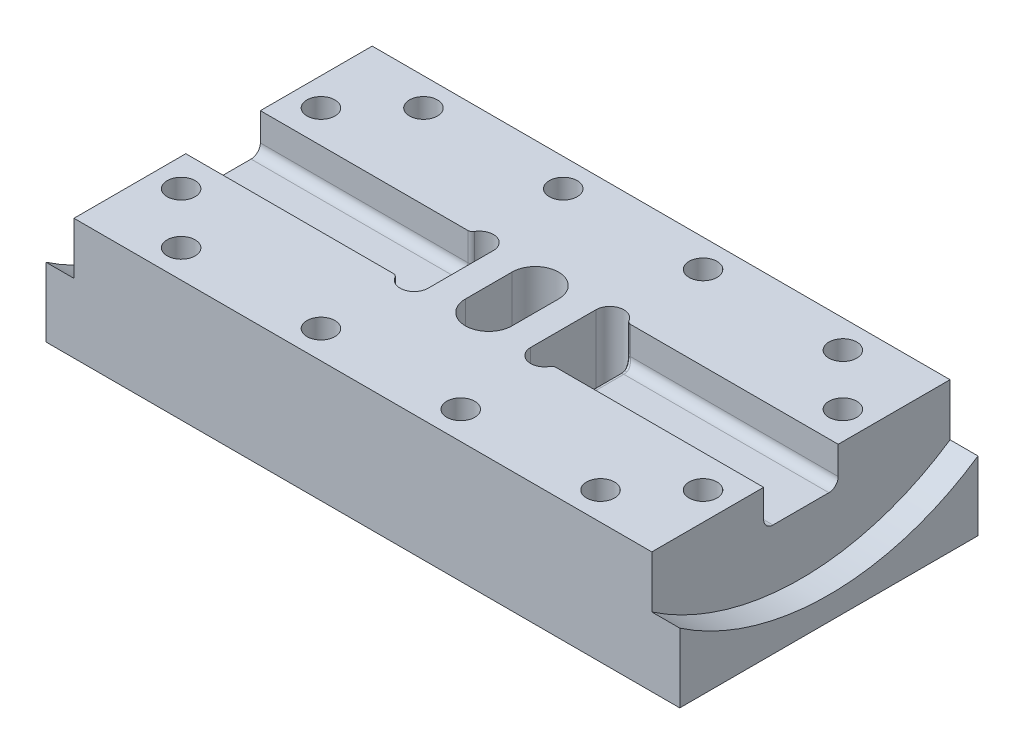
from build123d import *

# Parameters (mm, degrees)
SKETCH1_W           = 68
SKETCH1_H           = 32
BOSS_EXTRUDE1_DEPTH = 13
SKETCH2_R           = 1.5
CUT_EXTRUDE1_DEPTH  = 40.761790704
CUT_EXTRUDE2_DEPTH  = 40.761790704
CUT_EXTRUDE3_START  = -34
CUT_EXTRUDE3_DEPTH  = 3
CUT_EXTRUDE4_START  = 31
CUT_EXTRUDE4_DEPTH  = 3
CUT_EXTRUDE5_DEPTH  = 23
CUT_EXTRUDE6_START  = -23
CUT_EXTRUDE6_DEPTH  = 23
FILLET1_R           = 0.5


with BuildPart() as part:
    # Sketch1 → Boss-Extrude1 (new body)
    with BuildSketch(Plane(origin=(0, 0, 0), x_dir=(1, 0, 0), z_dir=(0, 1, 0))):
        Rectangle(SKETCH1_W, SKETCH1_H)
    extrude(amount=BOSS_EXTRUDE1_DEPTH)

    # Sketch2 → Cut-Extrude1 (cut, through all)
    with BuildSketch(Plane(origin=(0, 13, 0), x_dir=(1, 0, 0), z_dir=(0, 1, 0))):
        with Locations(Location((-28, 7.5, 0), (0, 0, 270))):
            Circle(SKETCH2_R)
        with Locations(Location((-28, -7.5, 0), (0, 0, 270))):
            Circle(SKETCH2_R)
        with Locations(Location((28, -7.5, 0), (0, 0, 270))):
            Circle(SKETCH2_R)
        with Locations(Location((28, 7.5, 0), (0, 0, 270))):
            Circle(SKETCH2_R)
        with Locations(Location((-22.5, 13, 0), (0, 0, 270))):
            Circle(SKETCH2_R)
        with Locations(Location((-7.5, 13, 0), (0, 0, 270))):
            Circle(SKETCH2_R)
        with Locations(Location((7.5, 13, 0), (0, 0, 270))):
            Circle(SKETCH2_R)
        with Locations(Location((22.5, 13, 0), (0, 0, 270))):
            Circle(SKETCH2_R)
        with Locations(Location((-22.5, -13, 0), (0, 0, 270))):
            Circle(SKETCH2_R)
        with Locations(Location((-7.5, -13, 0), (0, 0, 270))):
            Circle(SKETCH2_R)
        with Locations(Location((7.5, -13, 0), (0, 0, 270))):
            Circle(SKETCH2_R)
        with Locations(Location((22.5, -13, 0), (0, 0, 270))):
            Circle(SKETCH2_R)
    extrude(amount=-CUT_EXTRUDE1_DEPTH, mode=Mode.SUBTRACT)

    # Sketch3 → Cut-Extrude2 (cut, through all)
    with BuildSketch(Plane(origin=(0, 13, 0), x_dir=(1, 0, 0), z_dir=(0, 1, 0))):
        with BuildLine():
            Line((-2.5, -2.5), (-2.5, 2.5))
            ThreePointArc((-2.5, 2.5), (0, 5), (2.5, 2.5))
            Line((2.5, 2.5), (2.5, -2.5))
            ThreePointArc((2.5, -2.5), (0, -5), (-2.5, -2.5))
        make_face()
        with BuildLine():
            Line((-8.5, -3.5), (-8.5, 3.5))
            ThreePointArc((-8.5, 3.5), (-7, 5), (-5.5, 3.5))
            Line((-5.5, 3.5), (-5.5, -3.5))
            ThreePointArc((-5.5, -3.5), (-7, -5), (-8.5, -3.5))
        make_face()
        with BuildLine():
            Line((8.5, -3.5), (8.5, 3.5))
            ThreePointArc((8.5, 3.5), (7, 5), (5.5, 3.5))
            Line((5.5, 3.5), (5.5, -3.5))
            ThreePointArc((5.5, -3.5), (7, -5), (8.5, -3.5))
        make_face()
    extrude(amount=-CUT_EXTRUDE2_DEPTH, mode=Mode.SUBTRACT)

    # Sketch5 → Cut-Extrude3 (cut)
    with BuildSketch(Plane(origin=(0, 0, 0), x_dir=(0, 0, -1), z_dir=(1, 0, 0)).offset(CUT_EXTRUDE3_START)):
        with BuildLine():
            Line((16, 7.41504717), (16, 13))
            Line((16, 13), (-16, 13))
            Line((-16, 13), (-16, 7.41504717))
            ThreePointArc((-16, 7.41504717), (0, 2.5), (16, 7.41504717))
        make_face()
    extrude(amount=CUT_EXTRUDE3_DEPTH, mode=Mode.SUBTRACT)

    # Sketch6 → Cut-Extrude4 (cut)
    with BuildSketch(Plane(origin=(0, 0, 0), x_dir=(0, 0, -1), z_dir=(1, 0, 0)).offset(CUT_EXTRUDE4_START)):
        with BuildLine():
            Line((16, 7.41504717), (16, 13))
            Line((16, 13), (-16, 13))
            Line((-16, 13), (-16, 7.41504717))
            ThreePointArc((-16, 7.41504717), (0, 2.5), (16, 7.41504717))
        make_face()
    extrude(amount=CUT_EXTRUDE4_DEPTH, mode=Mode.SUBTRACT)

    # Sketch7 → Cut-Extrude5 (cut)
    with BuildSketch(Plane.ZY.offset(31)):
        with BuildLine():
            Line((-4, 13), (4, 13))
            Line((4, 13), (4, 10))
            ThreePointArc((4, 10), (3.707106781, 9.292893219), (3, 9))
            Line((3, 9), (-3, 9))
            ThreePointArc((-3, 9), (-3.707106781, 9.292893219), (-4, 10))
            Line((-4, 10), (-4, 13))
        make_face()
    extrude(amount=-CUT_EXTRUDE5_DEPTH, mode=Mode.SUBTRACT)

    # Sketch8 → Cut-Extrude6 (cut)
    with BuildSketch(Plane(origin=(31, 0, 0), x_dir=(0, 0, -1), z_dir=(1, 0, 0)).offset(CUT_EXTRUDE6_START)):
        with BuildLine():
            Line((4, 13), (-4, 13))
            Line((-4, 13), (-4, 10))
            ThreePointArc((-4, 10), (-3.707106781, 9.292893219), (-3, 9))
            Line((-3, 9), (3, 9))
            ThreePointArc((3, 9), (3.707106781, 9.292893219), (4, 10))
            Line((4, 10), (4, 13))
        make_face()
    extrude(amount=CUT_EXTRUDE6_DEPTH, mode=Mode.SUBTRACT)

    # Fillet1
    fillet1_edges = [part.edges().sort_by_distance(p)[0] for p in [
        (-8.414213562, 11.5, -4),
        (-8.414213562, 11.5, 4),
        (-8.5, 9.034074174, 3.258819045),
        (-8.454681198, 9.499830019, 3.865927225),
        (-8.5, 9, 0),
        (-8.454681197, 9.499830019, -3.865927225),
        (-8.5, 9.034074174, -3.258819045),
        (8.414213562, 11.5, -4),
        (8.5, 9.034074174, -3.258819045),
        (8.454681197, 9.499830019, -3.865927225),
        (8.5, 9, 0),
        (8.454681198, 9.499830019, 3.865927225),
        (8.5, 9.034074174, 3.258819045),
        (8.414213562, 11.5, 4),
    ]]
    fillet(fillet1_edges, radius=FILLET1_R)


solid = part.part
